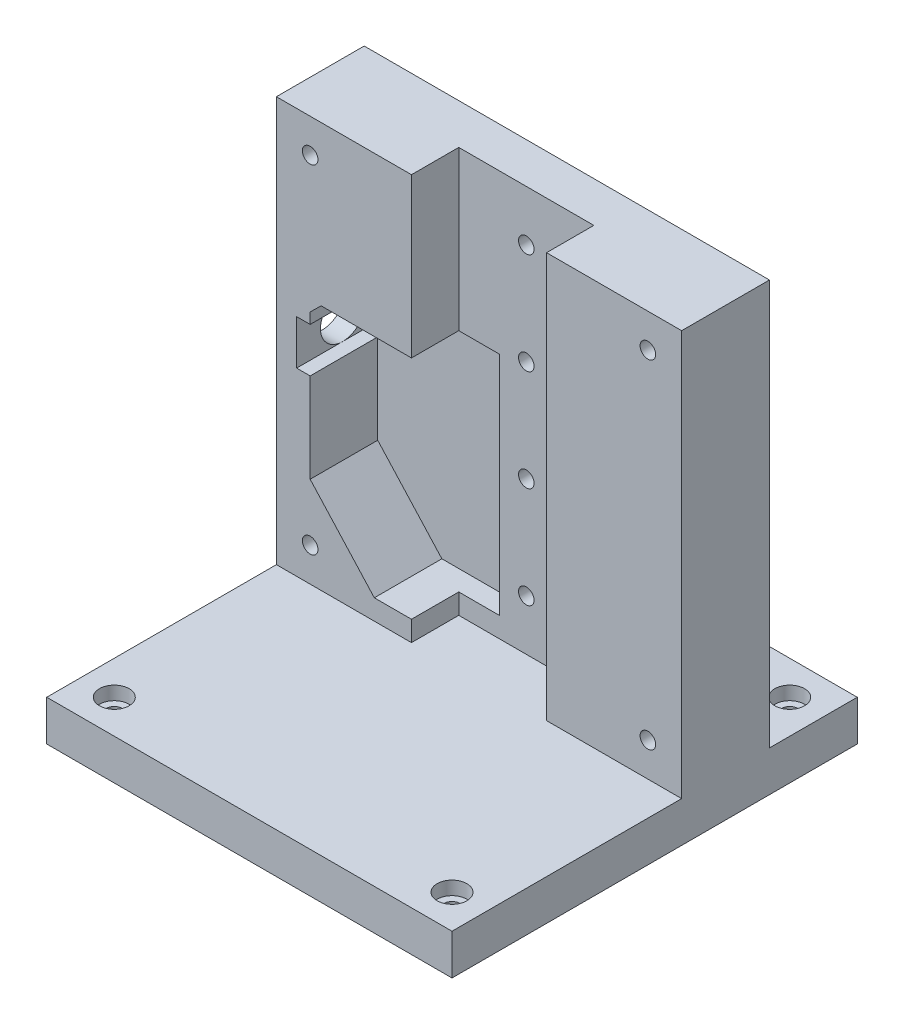
from build123d import *

# Parameters (mm, degrees)
SKETCH1_W           = 60
SKETCH1_H           = 60
BOSS_EXTRUDE1_DEPTH = 6
CUT_EXTRUDE2_DEPTH  = 3
SKETCH12_R          = 1.15
CUT_EXTRUDE9_DEPTH  = 43.848570571
SKETCH5_W           = 20
SKETCH5_H           = 60
BOSS_EXTRUDE2_DEPTH = 7
SKETCH6_R           = 1.15
CUT_EXTRUDE4_DEPTH  = 45.373415465
CUT_EXTRUDE6_DEPTH  = 10
SKETCH10_W          = 6
SKETCH10_H          = 33.5
CUT_EXTRUDE7_DEPTH  = 3
CUT_EXTRUDE8_DEPTH  = 66.711490624
SKETCH13_W          = 60
SKETCH13_H          = 60
BOSS_EXTRUDE3_DEPTH = 6
SKETCH14_R          = 1.15
CUT_EXTRUDE10_DEPTH = 82.908485519
SKETCH15_R          = 2.2
CUT_EXTRUDE11_DEPTH = 2


with BuildPart() as part:
    # Sketch1 → Boss-Extrude1 (new body)
    with BuildSketch(Plane.XY):
        Rectangle(SKETCH1_W, SKETCH1_H)
    extrude(amount=BOSS_EXTRUDE1_DEPTH)

    # Sketch3 → Cut-Extrude2 (cut)
    with BuildSketch(Plane(origin=(0, 0, 0), x_dir=(-1, 0, 0), z_dir=(0, 0, -1))):
        Polygon((2.1, 6.287564435), (2.1, 8.712435565), (0, 9.924871131), (-2.1, 8.712435565), (-2.1, 6.287564435), (0, 5.075128869), align=None)
        Polygon((2.1, -8.712435565), (2.1, -6.287564435), (0, -5.075128869), (-2.1, -6.287564435), (-2.1, -8.712435565), (0, -9.924871131), align=None)
        Polygon((2.1, -23.712435565), (2.1, -21.287564435), (0, -20.075128869), (-2.1, -21.287564435), (-2.1, -23.712435565), (0, -24.924871131), align=None)
        Polygon((0, 20.075128869), (2.1, 21.287564435), (2.1, 23.712435565), (0, 24.924871131), (-2.1, 23.712435565), (-2.1, 21.287564435), align=None)
    extrude(amount=-CUT_EXTRUDE2_DEPTH, mode=Mode.SUBTRACT)

    # Sketch12 → Cut-Extrude9 (cut, through all)
    with BuildSketch(Plane(origin=(0, 0, 0), x_dir=(-1, 0, 0), z_dir=(0, 0, -1))):
        with Locations((0, 22.5)):
            Circle(SKETCH12_R)
        with Locations((0, 7.5)):
            Circle(SKETCH12_R)
        with Locations((0, -7.5)):
            Circle(SKETCH12_R)
        with Locations((0, -22.5)):
            Circle(SKETCH12_R)
    extrude(amount=-CUT_EXTRUDE9_DEPTH, mode=Mode.SUBTRACT)

    # Sketch5 → Boss-Extrude2 (add)
    with BuildSketch(Plane.XY.offset(6)):
        with Locations((-20, 0)):
            Rectangle(SKETCH5_W, SKETCH5_H)
        with Locations((20, 0)):
            Rectangle(SKETCH5_W, SKETCH5_H)
    extrude(amount=BOSS_EXTRUDE2_DEPTH)

    # Sketch6 → Cut-Extrude4 (cut, through all)
    with BuildSketch(Plane.XY.offset(13)):
        with Locations((-25, 25)):
            Circle(SKETCH6_R)
        with Locations((25, 25)):
            Circle(SKETCH6_R)
        with Locations((25, -25)):
            Circle(SKETCH6_R)
        with Locations((-25, -25)):
            Circle(SKETCH6_R)
    extrude(amount=-CUT_EXTRUDE4_DEPTH, mode=Mode.SUBTRACT)

    # Sketch9 → Cut-Extrude6 (cut)
    with BuildSketch(Plane.XY.offset(13)):
        Polygon((-25, -16.55), (-15.5, -27), (-10, -27), (-10, 6.5), (-23.375, 6.5), (-25, 4.9), (-25, 3.3), (-27, 3.3), (-27, -3.3), (-25, -3.3), align=None)
    extrude(amount=-CUT_EXTRUDE6_DEPTH, mode=Mode.SUBTRACT)

    # Sketch10 → Cut-Extrude7 (cut)
    with BuildSketch(Plane.XY.offset(6)):
        with Locations((-7, -10.25)):
            Rectangle(SKETCH10_W, SKETCH10_H)
    extrude(amount=-CUT_EXTRUDE7_DEPTH, mode=Mode.SUBTRACT)

    # Sketch11 → Cut-Extrude8 (cut, through all)
    with BuildSketch(Plane(origin=(-27, 0, 0), x_dir=(0, 0, -1), z_dir=(1, 0, 0))):
        with BuildLine():
            Line((-3, -0.899652711), (-3, 0.899652711))
            ThreePointArc((-3, 0.899652711), (-9.475, 0), (-3, -0.899652711))
        make_face()
    extrude(amount=-CUT_EXTRUDE8_DEPTH, mode=Mode.SUBTRACT)

    # Sketch13 → Boss-Extrude3 (add)
    with BuildSketch(Plane(origin=(0, -30, 0), x_dir=(-1, 0, 0), z_dir=(0, -1, 0))):
        with Locations((0, -17)):
            Rectangle(SKETCH13_W, SKETCH13_H)
    extrude(amount=BOSS_EXTRUDE3_DEPTH)

    # Sketch14 → Cut-Extrude10 (cut, through all)
    with BuildSketch(Plane(origin=(0, -30, 0), x_dir=(1, 0, 0), z_dir=(0, 1, 0))):
        with BuildLine():
            ThreePointArc((-25.813172798, 8.813172798), (-25.813172798, 7.186827202), (-24.186827202, 7.186827202))
            Line((-24.186827202, 7.186827202), (-25.813172798, 8.813172798))
        make_face()
        with BuildLine():
            Line((-25.813172798, 8.813172798), (-24.186827202, 7.186827202))
            ThreePointArc((-24.186827202, 7.186827202), (-23.937538538, 7.559914053), (-23.85, 8))
            ThreePointArc((-23.85, 8), (-24.559914053, 9.062461462), (-25.813172798, 8.813172798))
        make_face()
        with Locations(Location((25, 8, 0), (0, 0, 270))):
            Circle(SKETCH14_R)
        with BuildLine():
            ThreePointArc((26.15, -42), (25.440085947, -40.937538538), (24.186827202, -41.186827202))
            Line((24.186827202, -41.186827202), (25.813172798, -42.813172798))
            ThreePointArc((25.813172798, -42.813172798), (26.062461462, -42.440085947), (26.15, -42))
        make_face()
        with BuildLine():
            Line((25.813172798, -42.813172798), (24.186827202, -41.186827202))
            ThreePointArc((24.186827202, -41.186827202), (24.186827202, -42.813172798), (25.813172798, -42.813172798))
        make_face()
        with Locations(Location((-25, -42, 0), (0, 0, 270))):
            Circle(SKETCH14_R)
    extrude(amount=-CUT_EXTRUDE10_DEPTH, mode=Mode.SUBTRACT)

    # Sketch15 → Cut-Extrude11 (cut)
    with BuildSketch(Plane(origin=(0, -30, 0), x_dir=(1, 0, 0), z_dir=(0, 1, 0))):
        with Locations(Location((25, -42, 0), (0, 0, 270))):
            Circle(SKETCH15_R)
        with Locations(Location((-25, -42, 0), (0, 0, 270))):
            Circle(SKETCH15_R)
        with Locations(Location((-25, 8, 0), (0, 0, 270))):
            Circle(SKETCH15_R)
        with Locations(Location((25, 8, 0), (0, 0, 270))):
            Circle(SKETCH15_R)
    extrude(amount=-CUT_EXTRUDE11_DEPTH, mode=Mode.SUBTRACT)


solid = part.part
